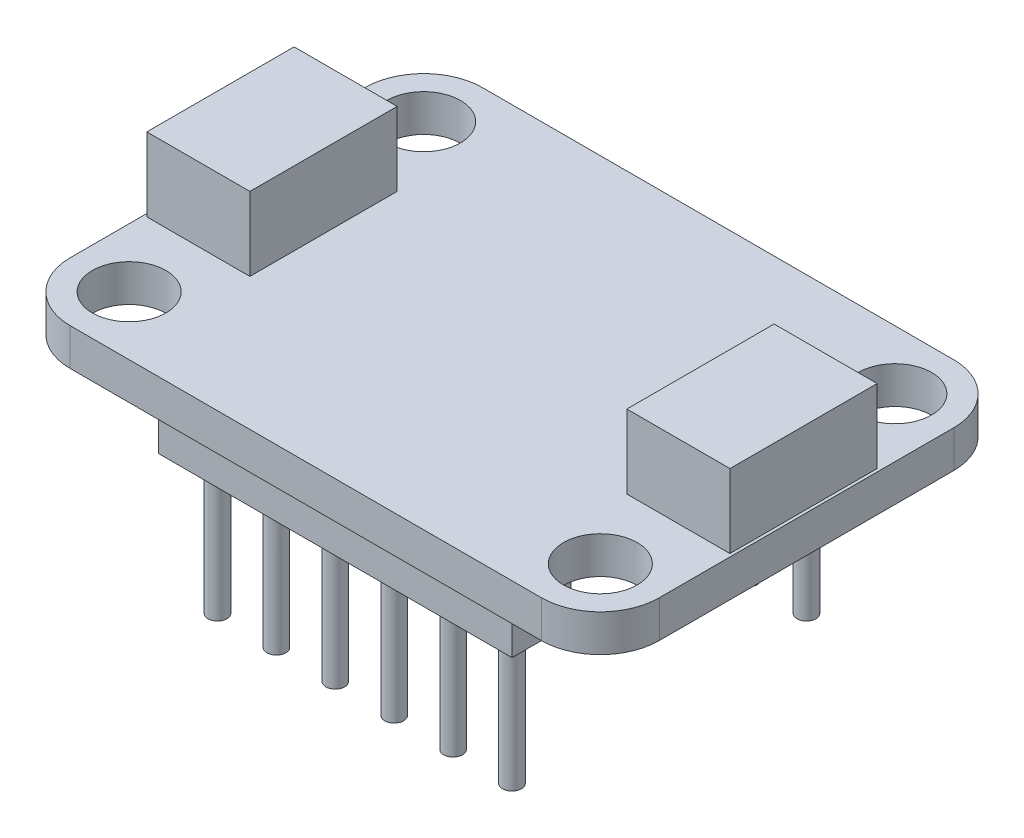
from build123d import *

# Parameters (mm, degrees)
SKETCH1_W               = 25.4
SKETCH1_H               = 17.78
BOSS_EXTRUDE1_DEPTH     = 1.6002
CUT_EXTRUDE1_DEPTH      = 16.584695699
CUT_EXTRUDE1_DEPTH_BACK = 16.584695699
SKETCH2_R               = 1.5875
SKETCH3_W               = 15.24
SKETCH3_H               = 2.54
BOSS_EXTRUDE2_DEPTH     = 2.54
SKETCH4_R               = 0.4064
BOSS_EXTRUDE3_DEPTH     = 5.969
LPATTERN1_COUNT         = 6
LPATTERN1_PITCH         = 2.54
MIRROR1_COPY_1_SKETCH_R = 0.4064
MIRROR1_COPY_1_DEPTH    = 5.969
MIRROR1_COPY_2_SKETCH_R = 0.4064
MIRROR1_COPY_2_DEPTH    = 5.969
MIRROR1_COPY_3_SKETCH_R = 0.4064
MIRROR1_COPY_3_DEPTH    = 5.969
MIRROR1_COPY_4_SKETCH_R = 0.4064
MIRROR1_COPY_4_DEPTH    = 5.969
MIRROR1_COPY_5_SKETCH_R = 0.4064
MIRROR1_COPY_5_DEPTH    = 5.969
SKETCH5_W               = 4.445
SKETCH5_H               = 6.35
BOSS_EXTRUDE4_DEPTH     = 3.175


with BuildPart() as part:
    # Sketch1 → Boss-Extrude1 (new body)
    with BuildSketch(Plane(origin=(0, 0, 0), x_dir=(1, 0, 0), z_dir=(0, 1, 0))):
        Rectangle(SKETCH1_W, SKETCH1_H)
    extrude(amount=BOSS_EXTRUDE1_DEPTH)

    # Sketch2 → Cut-Extrude1 (cut, two sides: drawn at the far end of the back side and taken through both)
    with BuildSketch(Plane(origin=(0, 1.6002, 0), x_dir=(1, 0, 0), z_dir=(0, 1, 0)).offset(-CUT_EXTRUDE1_DEPTH_BACK)):
        with Locations(Location((-10.16, 6.35, 0), (0, 0, 270))):
            Circle(SKETCH2_R)
        with Locations(Location((10.16, 6.35, 0), (0, 0, 270))):
            Circle(SKETCH2_R)
        with Locations(Location((10.16, -6.35, 0), (0, 0, 270))):
            Circle(SKETCH2_R)
        with Locations(Location((-10.16, -6.35, 0), (0, 0, 270))):
            Circle(SKETCH2_R)
        with BuildLine():
            Line((-12.7, 6.35), (-12.7, 8.89))
            Line((-12.7, 8.89), (-10.16, 8.89))
            ThreePointArc((-10.16, 8.89), (-11.956051224, 8.146051224), (-12.7, 6.35))
        make_face()
        with BuildLine():
            Line((10.16, 8.89), (12.7, 8.89))
            Line((12.7, 8.89), (12.7, 6.35))
            ThreePointArc((12.7, 6.35), (11.956051224, 8.146051224), (10.16, 8.89))
        make_face()
        with BuildLine():
            Line((10.16, -8.89), (12.7, -8.89))
            Line((12.7, -8.89), (12.7, -6.35))
            ThreePointArc((12.7, -6.35), (11.956051224, -8.146051224), (10.16, -8.89))
        make_face()
        with BuildLine():
            Line((-12.7, -6.35), (-12.7, -8.89))
            Line((-12.7, -8.89), (-10.16, -8.89))
            ThreePointArc((-10.16, -8.89), (-11.956051224, -8.146051224), (-12.7, -6.35))
        make_face()
    extrude(amount=CUT_EXTRUDE1_DEPTH + CUT_EXTRUDE1_DEPTH_BACK, mode=Mode.SUBTRACT)

    # Sketch3 → Boss-Extrude2 (add)
    with BuildSketch(Plane.XZ):
        with Locations((0, 6.35)):
            Rectangle(SKETCH3_W, SKETCH3_H)
    boss_extrude2 = extrude(amount=BOSS_EXTRUDE2_DEPTH)

    # Sketch4 → Boss-Extrude3 (add)
    with BuildSketch(Plane.XZ.offset(2.54)):
        with Locations(Location((-6.35, 6.35, 0), (0, 0, 270))):
            Circle(SKETCH4_R)
    boss_extrude3 = extrude(amount=BOSS_EXTRUDE3_DEPTH)

    # LPattern1: Boss-Extrude3 ×6
    with Locations(*[(i * LPATTERN1_PITCH, 0, 0) for i in range(1, LPATTERN1_COUNT)]):
        add(boss_extrude3)

    # Mirror1: Boss-Extrude2, Boss-Extrude3 across plane
    add(boss_extrude2.mirror(Plane.XY))
    add(boss_extrude3.mirror(Plane.XY))

    # Mirror1 copy 1 sketch → Mirror1 copy 1 (add)
    with BuildSketch(Plane(origin=(2.54, -2.54, 0), x_dir=(1, 0, 0), z_dir=(0, -1, 0))):
        with Locations((-6.35, -6.35)):
            Circle(MIRROR1_COPY_1_SKETCH_R)
    extrude(amount=MIRROR1_COPY_1_DEPTH)

    # Mirror1 copy 2 sketch → Mirror1 copy 2 (add)
    with BuildSketch(Plane(origin=(5.08, -2.54, 0), x_dir=(1, 0, 0), z_dir=(0, -1, 0))):
        with Locations((-6.35, -6.35)):
            Circle(MIRROR1_COPY_2_SKETCH_R)
    extrude(amount=MIRROR1_COPY_2_DEPTH)

    # Mirror1 copy 3 sketch → Mirror1 copy 3 (add)
    with BuildSketch(Plane(origin=(7.62, -2.54, 0), x_dir=(1, 0, 0), z_dir=(0, -1, 0))):
        with Locations((-6.35, -6.35)):
            Circle(MIRROR1_COPY_3_SKETCH_R)
    extrude(amount=MIRROR1_COPY_3_DEPTH)

    # Mirror1 copy 4 sketch → Mirror1 copy 4 (add)
    with BuildSketch(Plane(origin=(10.16, -2.54, 0), x_dir=(1, 0, 0), z_dir=(0, -1, 0))):
        with Locations((-6.35, -6.35)):
            Circle(MIRROR1_COPY_4_SKETCH_R)
    extrude(amount=MIRROR1_COPY_4_DEPTH)

    # Mirror1 copy 5 sketch → Mirror1 copy 5 (add)
    with BuildSketch(Plane(origin=(12.7, -2.54, 0), x_dir=(1, 0, 0), z_dir=(0, -1, 0))):
        with Locations((-6.35, -6.35)):
            Circle(MIRROR1_COPY_5_SKETCH_R)
    extrude(amount=MIRROR1_COPY_5_DEPTH)

    # Sketch5 → Boss-Extrude4 (add)
    with BuildSketch(Plane(origin=(0, 1.6002, 0), x_dir=(1, 0, 0), z_dir=(0, 1, 0))):
        with Locations((-10.3505, 0)):
            Rectangle(SKETCH5_W, SKETCH5_H)
        with Locations((10.3505, 0)):
            Rectangle(SKETCH5_W, SKETCH5_H)
    extrude(amount=BOSS_EXTRUDE4_DEPTH)


solid = part.part
